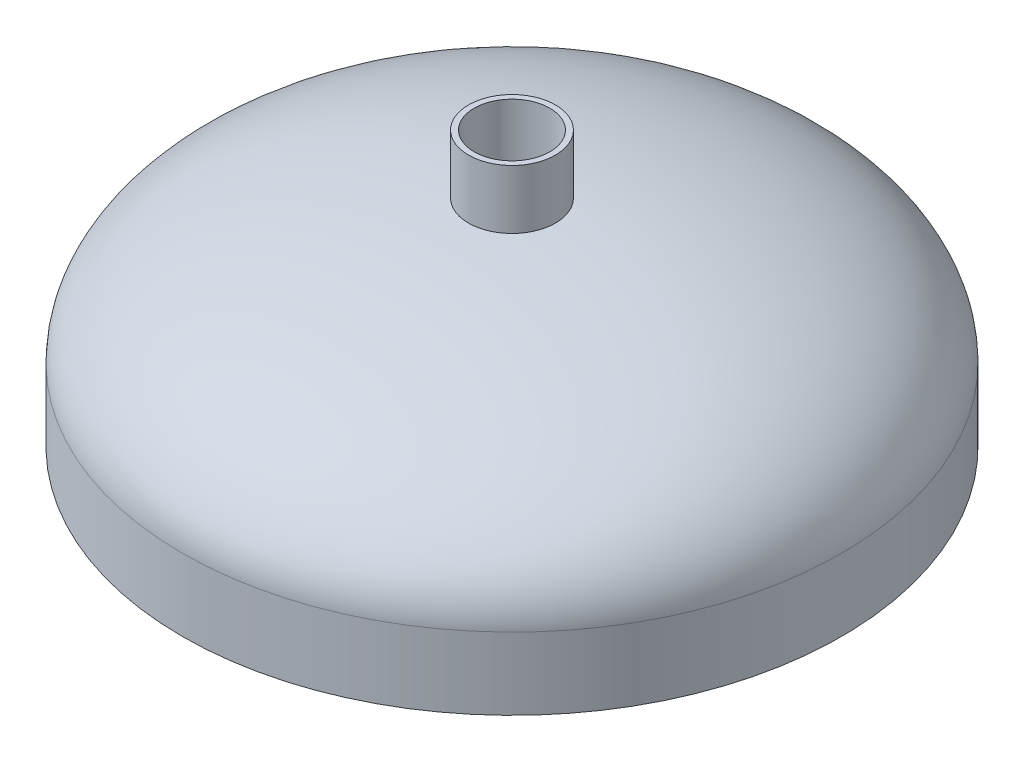
from build123d import *

# Parameters (mm, degrees)
CROQUIS1_R              = 228.6
SALIENTE_EXTRUIR1_DEPTH = 50
C_PULA1_FACE_RADIUS     = 228.6
C_PULA1_HEIGHT          = 100
VACIADO1_T              = -9.525
CROQUIS3_R              = 30.15
SALIENTE_EXTRUIR2_DEPTH = 60
CORTAR_EXTRUIR1_REACH   = 376.988
CROQUIS4_R              = 26.24


with BuildPart() as part:
    # Croquis1 → Saliente-Extruir1 (new body)
    with BuildSketch(Plane(origin=(0, 0, 0), x_dir=(1, 0, 0), z_dir=(0, 1, 0))):
        Circle(CROQUIS1_R)
    extrude(amount=SALIENTE_EXTRUIR1_DEPTH)

    # Cúpula1: an elliptical dome of height H over a round flat face of radius A is half a spheroid: the quarter ellipse of half axes A and H revolved about the face's axis
    with BuildSketch(Plane((0, 50, 0), x_dir=(0, 0, -1), z_dir=(1, 0, 0)), mode=Mode.PRIVATE) as c_pula1_quarter:
        Ellipse(C_PULA1_FACE_RADIUS, C_PULA1_HEIGHT)
        Rectangle(C_PULA1_FACE_RADIUS, C_PULA1_HEIGHT, align=(Align.MIN, Align.MIN), mode=Mode.INTERSECT)
    revolve(c_pula1_quarter.sketch, axis=Axis((0, 50, 0), (0, 1, 0)))

    # Vaciado1
    vaciado1_openings = [part.faces().sort_by_distance(p)[0] for p in [
        (0, 0, 0),
    ]]
    offset(amount=VACIADO1_T, openings=vaciado1_openings, kind=Kind.INTERSECTION)

    # Croquis3 → Saliente-Extruir2 (add)
    with BuildSketch(Plane(origin=(0, 190, 0), x_dir=(1, 0, 0), z_dir=(0, 1, 0))):
        Circle(CROQUIS3_R)
    extrude(amount=-SALIENTE_EXTRUIR2_DEPTH)

    # Croquis4 → Cortar-Extruir1 (cut, up to next)
    with BuildSketch(Plane(origin=(0, 190, 0), x_dir=(1, 0, 0), z_dir=(0, 1, 0)), mode=Mode.PRIVATE) as cortar_extruir1_sk1:
        Circle(CROQUIS4_R)
    cortar_extruir1_tool1 = extrude(cortar_extruir1_sk1.sketch, amount=-CORTAR_EXTRUIR1_REACH, mode=Mode.PRIVATE) & part.part
    add(cortar_extruir1_tool1.solids().sort_by_distance((0, 190, 0))[0], mode=Mode.SUBTRACT)


solid = part.part
